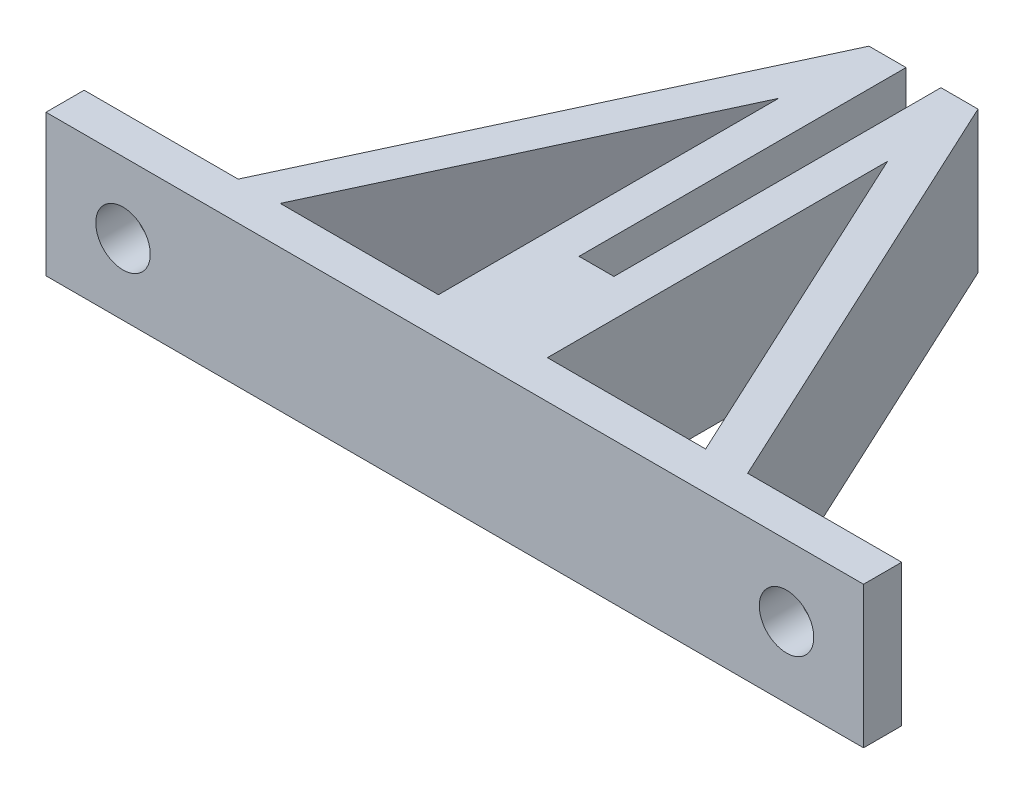
from build123d import *

# Parameters (mm, degrees)
BOSS_EXTRUDE1_DEPTH = 13
SKETCH1_6_W         = 3.2
SKETCH1_6_H         = 30
BOSS_EXTRUDE2_DEPTH = 7
SKETCH2_R           = 2.5
CUT_EXTRUDE1_DEPTH  = 7


with BuildPart() as part:
    # Sketch1 → Boss-Extrude1 (new body)
    with BuildSketch(Plane(origin=(0, 0, 0), x_dir=(1, 0, 0), z_dir=(0, 1, 0))):
        Polygon((36.900921659, -27.476958525), (36.900921659, -23.976958525), (22.773014682, -23.976958525), (4.400921659, 15.523041475), (1.000921659, 15.523041475), (1.000921659, -14.476958525), (-2.199078341, -14.476958525), (-2.199078341, 15.523041475), (-5.599078341, 15.523041475), (-23.971171364, -23.976958525), (-38.099078341, -23.976958525), (-38.099078341, -27.476958525), align=None)
        Polygon((-5.599078341, -23.976958525), (-20.111109043, -23.976958525), (-5.599078341, 7.223907484), align=None, mode=Mode.SUBTRACT)
        Polygon((4.400921659, -23.976958525), (4.400921659, 7.223907484), (18.912952361, -23.976958525), align=None, mode=Mode.SUBTRACT)
    extrude(amount=BOSS_EXTRUDE1_DEPTH)

    # Sketch1<6> → Boss-Extrude2 (add)
    with BuildSketch(Plane(origin=(0, 0, 0), x_dir=(1, 0, 0), z_dir=(0, 1, 0))):
        with Locations((-0.599078341, 0.523041475)):
            Rectangle(SKETCH1_6_W, SKETCH1_6_H)
    extrude(amount=BOSS_EXTRUDE2_DEPTH)

    # Sketch2 → Cut-Extrude1 (cut)
    with BuildSketch(Plane(origin=(0, 0, 23.976958525), x_dir=(-1, 0, 0), z_dir=(0, 0, -1))):
        with Locations((31.035124853, 6.5)):
            Circle(SKETCH2_R)
        with Locations((-29.836968171, 6.5)):
            Circle(SKETCH2_R)
    extrude(amount=-CUT_EXTRUDE1_DEPTH, mode=Mode.SUBTRACT)


solid = part.part
